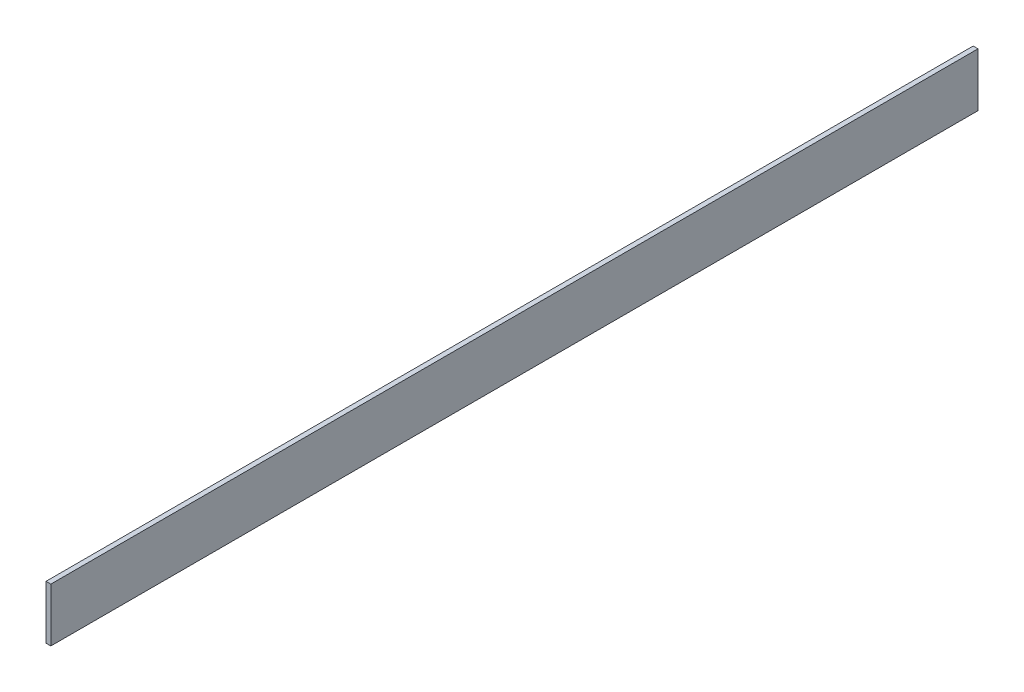
from build123d import *

# Parameters (mm, degrees)
SKETCH1_W           = 1219.2
SKETCH1_H           = 70.485
BOSS_EXTRUDE1_DEPTH = 6.35


with BuildPart() as part:
    # Sketch1 → Boss-Extrude1 (new body)
    with BuildSketch(Plane(origin=(0, 0, 0), x_dir=(0, 0, -1), z_dir=(1, 0, 0))):
        with Locations((0, 35.2425)):
            Rectangle(SKETCH1_W, SKETCH1_H)
    extrude(amount=BOSS_EXTRUDE1_DEPTH)


solid = part.part
